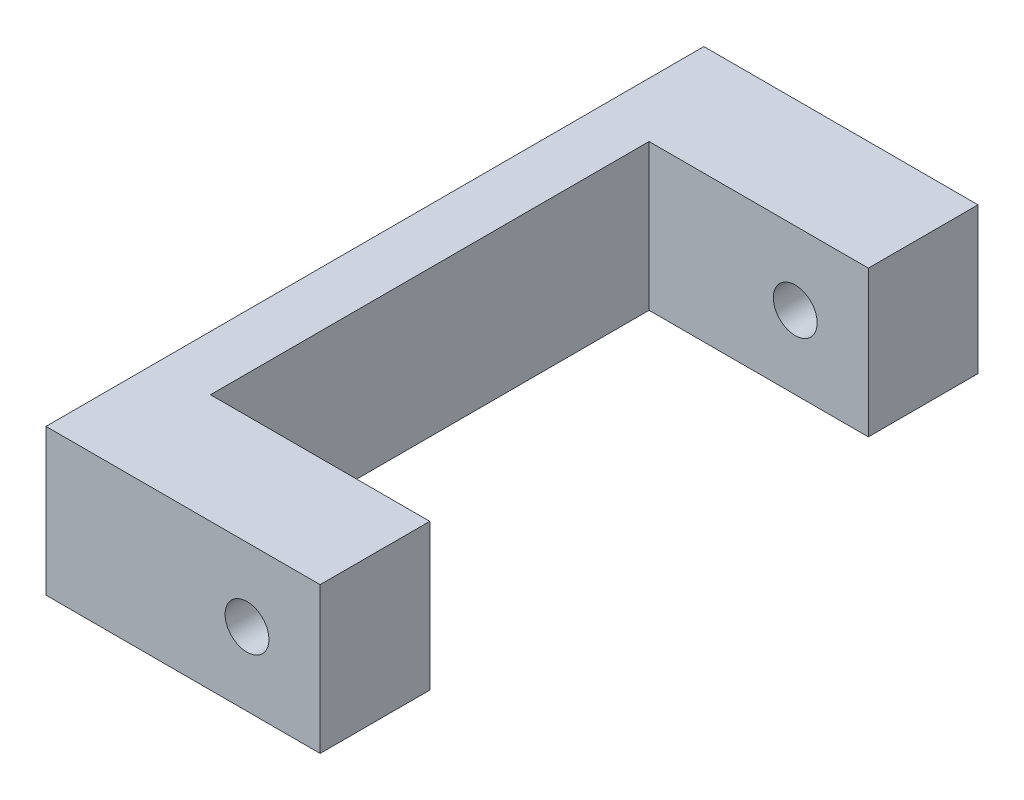
from build123d import *

# Parameters (mm, degrees)
SKETCH1_W               = 180
SKETCH1_H               = 40
BOSS_EXTRUDE1_DEPTH     = 15
SKETCH1_3_W             = 30
SKETCH1_3_H             = 40
BOSS_EXTRUDE2_DEPTH     = 60
CUT_EXTRUDE1_DEPTH      = 163.788205961
CUT_EXTRUDE1_DEPTH_BACK = 163.788205961
SKETCH2_R               = 6


with BuildPart() as part:
    # Sketch1 → Boss-Extrude1 (new body)
    with BuildSketch(Plane(origin=(0, 0, 0), x_dir=(0, 0, -1), z_dir=(1, 0, 0))):
        Rectangle(SKETCH1_W, SKETCH1_H)
    extrude(amount=-BOSS_EXTRUDE1_DEPTH)

    # Sketch1<3> → Boss-Extrude2 (add)
    with BuildSketch(Plane(origin=(0, 0, 0), x_dir=(0, 0, -1), z_dir=(1, 0, 0))):
        with Locations((-75, 0)):
            Rectangle(SKETCH1_3_W, SKETCH1_3_H)
        with Locations((75, 0)):
            Rectangle(SKETCH1_3_W, SKETCH1_3_H)
    extrude(amount=BOSS_EXTRUDE2_DEPTH)

    # Sketch2 → Cut-Extrude1 (cut, two sides: drawn at the far end of the back side and taken through both)
    with BuildSketch(Plane(origin=(0, 0, 60), x_dir=(-1, 0, 0), z_dir=(0, 0, -1)).offset(-CUT_EXTRUDE1_DEPTH_BACK)):
        with Locations((-40, 0)):
            Circle(SKETCH2_R)
    extrude(amount=CUT_EXTRUDE1_DEPTH + CUT_EXTRUDE1_DEPTH_BACK, mode=Mode.SUBTRACT)


solid = part.part
